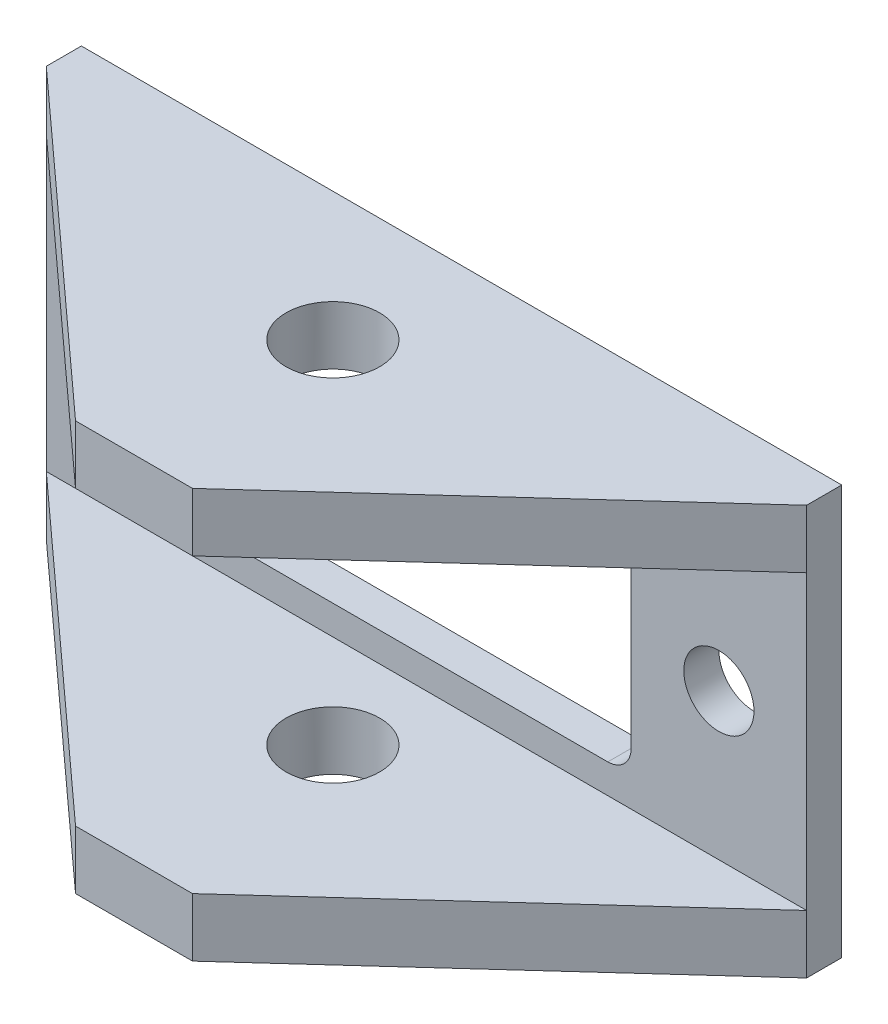
from build123d import *

# Parameters (mm, degrees)
BOSS_EXTRUDE1_DEPTH     = 35
CUT_EXTRUDE1_DEPTH      = 15.5
CUT_EXTRUDE1_DEPTH_BACK = 9.5
CUT_EXTRUDE2_DEPTH      = 51.214539727
CUT_EXTRUDE2_DEPTH_BACK = 51.214539727
SKETCH5_R               = 3
SKETCH5_W               = 35
SKETCH5_H               = 20
FILLET1_R               = 2
CUT_EXTRUDE3_DEPTH      = 51.214539727
CUT_EXTRUDE3_DEPTH_BACK = 51.214539727
SKETCH6_R               = 4


with BuildPart() as part:
    # Sketch1 → Boss-Extrude1 (new body)
    with BuildSketch(Plane(origin=(0, 0, 0), x_dir=(1, 0, 0), z_dir=(0, 1, 0))):
        Polygon((-32.5, 12.5), (32.5, 12.5), (32.5, 9.5), (5, -15.5), (-5, -15.5), (-32.5, 9.5), align=None)
    extrude(amount=BOSS_EXTRUDE1_DEPTH)

    # Sketch4 → Cut-Extrude1 (cut, two sides: drawn at the far end of the back side and taken through both)
    with BuildSketch(Plane.XY.offset(-CUT_EXTRUDE1_DEPTH_BACK)):
        Polygon((-23.214285714, 30), (23.214285714, 5), (32.5, 5), (32.5, 30), align=None)
        Polygon((-32.5, 5), (23.214285714, 5), (-23.214285714, 30), (-32.5, 30), align=None)
    extrude(amount=CUT_EXTRUDE1_DEPTH + CUT_EXTRUDE1_DEPTH_BACK, mode=Mode.SUBTRACT)

    # Sketch5 → Cut-Extrude2 (cut, two sides: drawn at the far end of the back side and taken through both)
    with BuildSketch(Plane.XY.offset(-CUT_EXTRUDE2_DEPTH_BACK)):
        with Locations((-25, 17.5)):
            Circle(SKETCH5_R)
        with Locations((25, 17.5)):
            Circle(SKETCH5_R)
        with Locations((0, 17.5)):
            Rectangle(SKETCH5_W, SKETCH5_H)
    extrude(amount=CUT_EXTRUDE2_DEPTH + CUT_EXTRUDE2_DEPTH_BACK, mode=Mode.SUBTRACT)

    # Fillet1
    fillet1_edges = [part.edges().sort_by_distance(p)[0] for p in [
        (17.5, 27.5, -11),
        (17.5, 7.5, -11),
        (-17.5, 7.5, -11),
        (-17.5, 27.5, -11),
    ]]
    fillet(fillet1_edges, radius=FILLET1_R)

    # Sketch6 → Cut-Extrude3 (cut, two sides: drawn at the far end of the back side and taken through both)
    with BuildSketch(Plane(origin=(0, 35, 0), x_dir=(1, 0, 0), z_dir=(0, 1, 0)).offset(-CUT_EXTRUDE3_DEPTH_BACK)):
        with Locations(Location((0, 1.5, 0), (0, 0, 270))):
            Circle(SKETCH6_R)
    extrude(amount=CUT_EXTRUDE3_DEPTH + CUT_EXTRUDE3_DEPTH_BACK, mode=Mode.SUBTRACT)


solid = part.part
